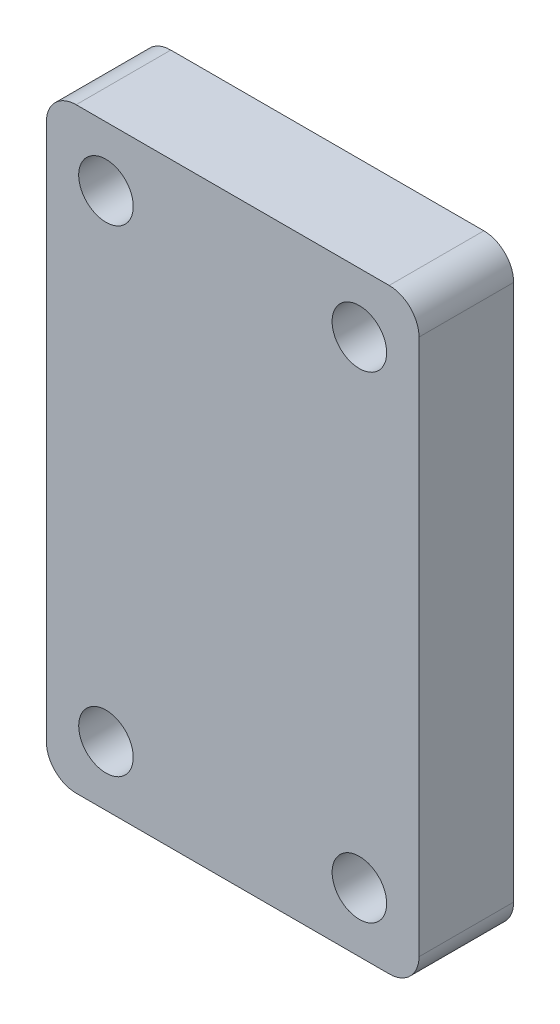
from build123d import *

# Parameters (mm, degrees)
ESQUISSE1_W             = 25
ESQUISSE1_H             = 40
BOSS_EXTRU_1_DEPTH      = 3.175
ENL_V_MAT_EXTRU_1_REACH = 26.425
ESQUISSE2_R             = 1.83
CONG_1_R                = 2


with BuildPart() as part:
    # Esquisse1 → Boss.-Extru.1 (new, symmetric)
    with BuildSketch(Plane.XY):
        Rectangle(ESQUISSE1_W, ESQUISSE1_H)
    extrude(amount=BOSS_EXTRU_1_DEPTH, both=True)

    # Esquisse2 → Enlèv. mat.-Extru.1 (cut, up to next)
    with BuildSketch(Plane.XY.offset(3.175), mode=Mode.PRIVATE) as enl_v_mat_extru_1_sk1:
        with Locations((-8.5, 16)):
            Circle(ESQUISSE2_R)
    enl_v_mat_extru_1_tool1 = extrude(enl_v_mat_extru_1_sk1.sketch, amount=-ENL_V_MAT_EXTRU_1_REACH, mode=Mode.PRIVATE) & part.part
    # Esquisse2 → Enlèv. mat.-Extru.1 (cut, up to next)
    with BuildSketch(Plane.XY.offset(3.175), mode=Mode.PRIVATE) as enl_v_mat_extru_1_sk2:
        with Locations((8.5, 16)):
            Circle(ESQUISSE2_R)
    enl_v_mat_extru_1_tool2 = extrude(enl_v_mat_extru_1_sk2.sketch, amount=-ENL_V_MAT_EXTRU_1_REACH, mode=Mode.PRIVATE) & part.part
    # Esquisse2 → Enlèv. mat.-Extru.1 (cut, up to next)
    with BuildSketch(Plane.XY.offset(3.175), mode=Mode.PRIVATE) as enl_v_mat_extru_1_sk3:
        with Locations((8.5, -16)):
            Circle(ESQUISSE2_R)
    enl_v_mat_extru_1_tool3 = extrude(enl_v_mat_extru_1_sk3.sketch, amount=-ENL_V_MAT_EXTRU_1_REACH, mode=Mode.PRIVATE) & part.part
    # Esquisse2 → Enlèv. mat.-Extru.1 (cut, up to next)
    with BuildSketch(Plane.XY.offset(3.175), mode=Mode.PRIVATE) as enl_v_mat_extru_1_sk4:
        with Locations((-8.5, -16)):
            Circle(ESQUISSE2_R)
    enl_v_mat_extru_1_tool4 = extrude(enl_v_mat_extru_1_sk4.sketch, amount=-ENL_V_MAT_EXTRU_1_REACH, mode=Mode.PRIVATE) & part.part
    add(enl_v_mat_extru_1_tool1.solids().sort_by_distance((-8.5, 16, 3.175))[0], mode=Mode.SUBTRACT)
    add(enl_v_mat_extru_1_tool2.solids().sort_by_distance((8.5, 16, 3.175))[0], mode=Mode.SUBTRACT)
    add(enl_v_mat_extru_1_tool3.solids().sort_by_distance((8.5, -16, 3.175))[0], mode=Mode.SUBTRACT)
    add(enl_v_mat_extru_1_tool4.solids().sort_by_distance((-8.5, -16, 3.175))[0], mode=Mode.SUBTRACT)

    # Congé1
    cong_1_edges = [part.edges().sort_by_distance(p)[0] for p in [
        (-12.5, 20, 0),
        (12.5, 20, 0),
        (12.5, -20, 0),
        (-12.5, -20, 0),
    ]]
    fillet(cong_1_edges, radius=CONG_1_R)


solid = part.part
